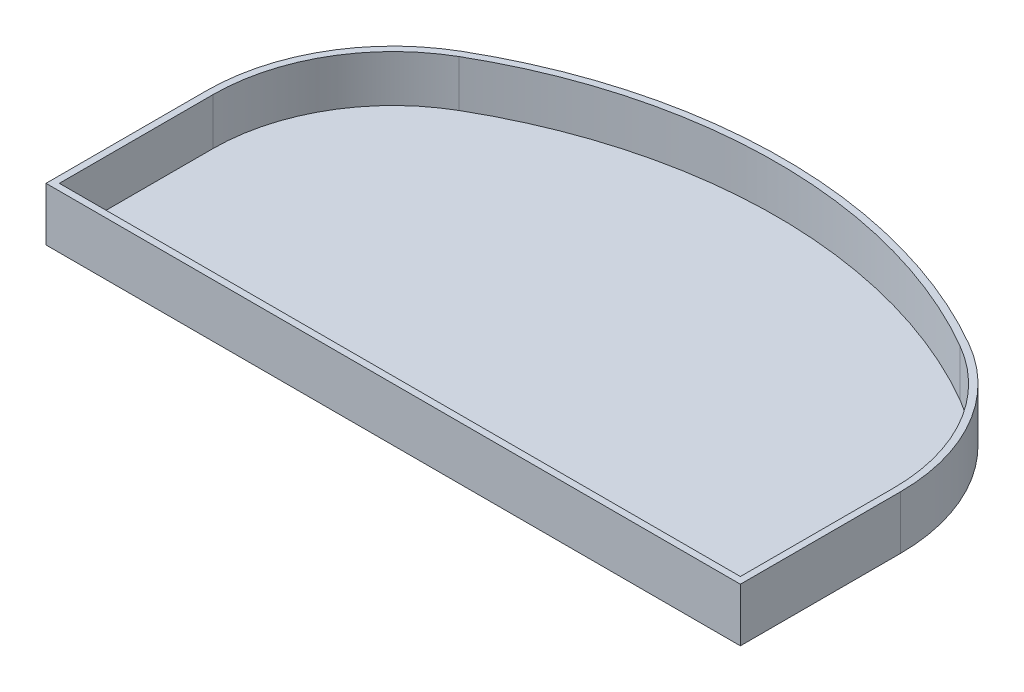
from build123d import *

# Parameters (mm, degrees)
BOSS_EXTRUDE1_DEPTH = 25.4
SHELL1_T            = -3.175


with BuildPart() as part:
    # Sketch1 → Boss-Extrude1 (new body)
    with BuildSketch(Plane(origin=(0, 0, 0), x_dir=(1, 0, 0), z_dir=(0, 1, 0))):
        with BuildLine():
            Line((0, 0), (330.2, 0))
            Line((330.2, 0), (330.2, 76.2))
            ThreePointArc((330.2, 76.2), (318.289658396, 120.65), (285.75, 153.189658396))
            ThreePointArc((285.75, 153.189658396), (165.1, 185.517728463), (44.45, 153.189658396))
            ThreePointArc((44.45, 153.189658396), (11.910341604, 120.65), (0, 76.2))
            Line((0, 76.2), (0, 0))
        make_face()
    extrude(amount=BOSS_EXTRUDE1_DEPTH)

    # Shell1
    shell1_openings = [part.faces().sort_by_distance(p)[0] for p in [
        (165.1, 25.4, -83.209110685),
    ]]
    offset(amount=SHELL1_T, openings=shell1_openings, kind=Kind.INTERSECTION)


solid = part.part
